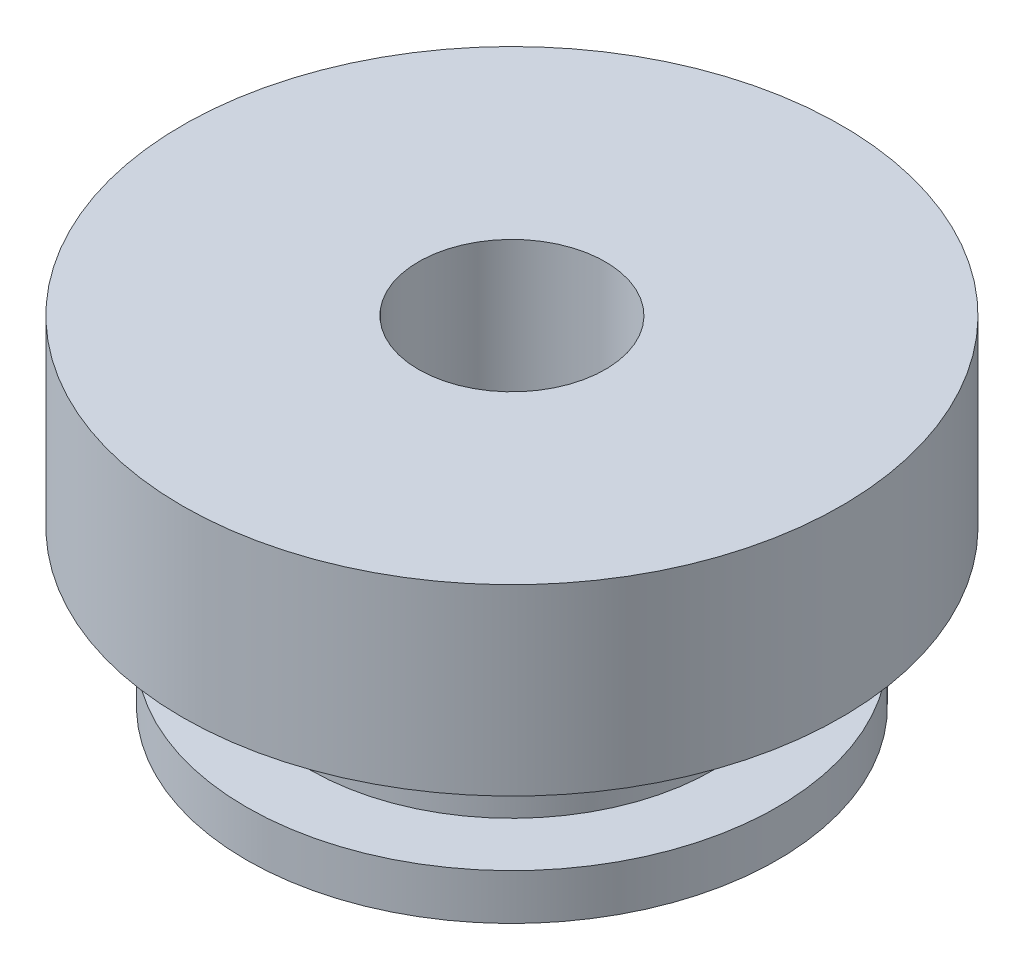
from build123d import *

# Parameters (mm, degrees)
SKETCH1_R           = 7.25
BOSS_EXTRUDE1_DEPTH = 1.25
SKETCH2_R           = 5.5
BOSS_EXTRUDE2_DEPTH = 3
SKETCH3_R           = 9
BOSS_EXTRUDE3_DEPTH = 5
SKETCH4_R           = 2.55
CUT_EXTRUDE1_DEPTH  = 8


with BuildPart() as part:
    # Sketch1 → Boss-Extrude1 (new body)
    with BuildSketch(Plane(origin=(0, 0, 0), x_dir=(1, 0, 0), z_dir=(0, 1, 0))):
        with Locations(Location((0, 0, 0), (0, 0, 270))):
            Circle(SKETCH1_R)
    extrude(amount=BOSS_EXTRUDE1_DEPTH)

    # Sketch2 → Boss-Extrude2 (add)
    with BuildSketch(Plane(origin=(0, 1.25, 0), x_dir=(1, 0, 0), z_dir=(0, 1, 0))):
        with Locations(Location((0, 0, 0), (0, 0, 270))):
            Circle(SKETCH2_R)
    extrude(amount=BOSS_EXTRUDE2_DEPTH)

    # Sketch3 → Boss-Extrude3 (add)
    with BuildSketch(Plane(origin=(0, 4.25, 0), x_dir=(1, 0, 0), z_dir=(0, 1, 0))):
        with Locations(Location((0, 0, 0), (0, 0, 270))):
            Circle(SKETCH3_R)
    extrude(amount=BOSS_EXTRUDE3_DEPTH)

    # Sketch4 → Cut-Extrude1 (cut)
    with BuildSketch(Plane(origin=(0, 9.25, 0), x_dir=(1, 0, 0), z_dir=(0, 1, 0))):
        with Locations(Location((0, 0, 0), (0, 0, 270))):
            Circle(SKETCH4_R)
    extrude(amount=-CUT_EXTRUDE1_DEPTH, mode=Mode.SUBTRACT)


solid = part.part
